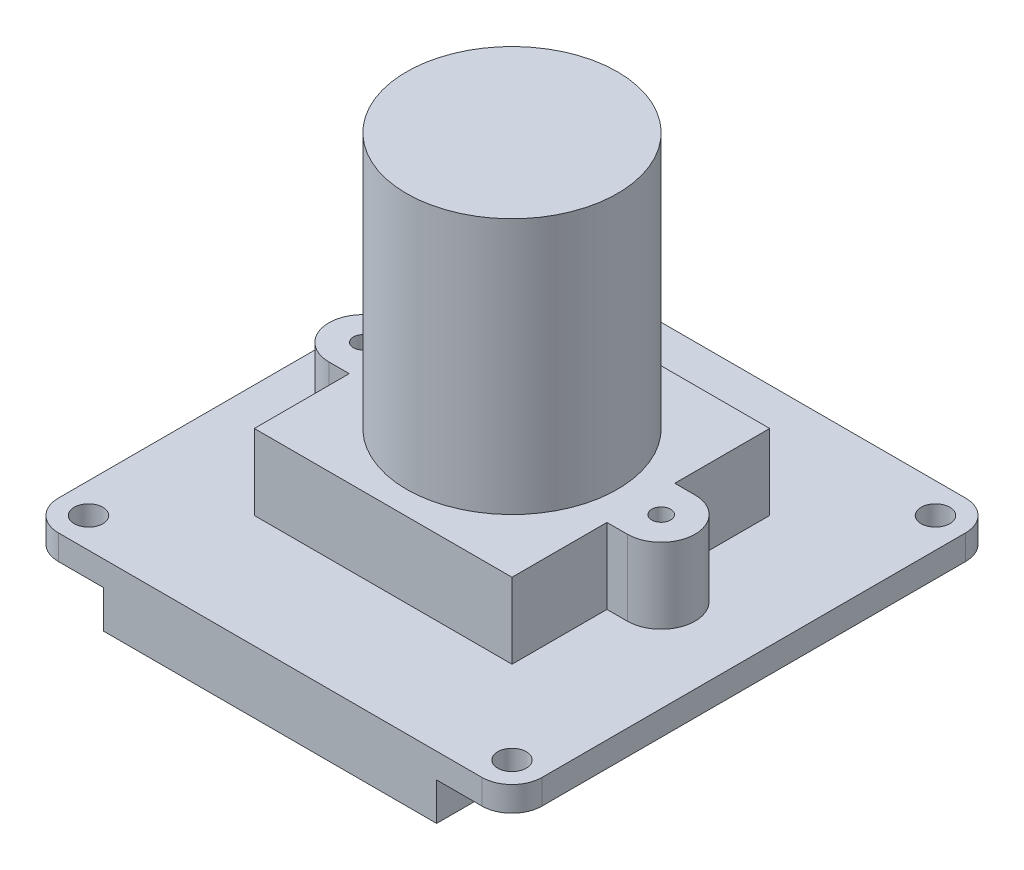
from build123d import *

# Parameters (mm, degrees)
SKETCH1_W           = 32.1
SKETCH1_H           = 32.1
SKETCH1_R           = 0.95
BOSS_EXTRUDE1_DEPTH = 1.65
SKETCH2_W           = 22.1
SKETCH2_H           = 6.75
BOSS_EXTRUDE2_DEPTH = 2.5
SKETCH3_R           = 0.625
BOSS_EXTRUDE3_DEPTH = 5
SKETCH4_R           = 7
BOSS_EXTRUDE4_DEPTH = 17
FILLET1_R           = 2


with BuildPart() as part:
    # Sketch1 → Boss-Extrude1 (new body)
    with BuildSketch(Plane(origin=(0, 0, 0), x_dir=(1, 0, 0), z_dir=(0, 1, 0))):
        Rectangle(SKETCH1_W, SKETCH1_H)
        with Locations(Location((-14.05, 14.05, 0), (0, 0, 270))):
            Circle(SKETCH1_R, mode=Mode.SUBTRACT)
        with Locations(Location((14.05, 14.05, 0), (0, 0, 90))):
            Circle(SKETCH1_R, mode=Mode.SUBTRACT)
        with Locations(Location((14.05, -14.05, 0), (0, 0, 270))):
            Circle(SKETCH1_R, mode=Mode.SUBTRACT)
        with Locations(Location((-14.05, -14.05, 0), (0, 0, 90))):
            Circle(SKETCH1_R, mode=Mode.SUBTRACT)
    extrude(amount=BOSS_EXTRUDE1_DEPTH)

    # Sketch2 → Boss-Extrude2 (add)
    with BuildSketch(Plane.XZ):
        with Locations((0, 12.675)):
            Rectangle(SKETCH2_W, SKETCH2_H)
    extrude(amount=BOSS_EXTRUDE2_DEPTH)

    # Sketch3 → Boss-Extrude3 (add)
    with BuildSketch(Plane(origin=(0, 1.65, 0), x_dir=(1, 0, 0), z_dir=(0, 1, 0))):
        with BuildLine():
            Line((9.9, 2.25), (8.55, 2.25))
            Line((8.55, 2.25), (8.55, 8.55))
            Line((8.55, 8.55), (-8.55, 8.55))
            Line((-8.55, 8.55), (-8.55, 2.25))
            Line((-8.55, 2.25), (-9.9, 2.25))
            ThreePointArc((-9.9, 2.25), (-12.15, 0), (-9.9, -2.25))
            Line((-9.9, -2.25), (-8.55, -2.25))
            Line((-8.55, -2.25), (-8.55, -8.55))
            Line((-8.55, -8.55), (8.55, -8.55))
            Line((8.55, -8.55), (8.55, -2.25))
            Line((8.55, -2.25), (9.9, -2.25))
            ThreePointArc((9.9, -2.25), (12.15, 0), (9.9, 2.25))
        make_face()
        with Locations(Location((9.9, 0, 0), (0, 0, 270))):
            Circle(SKETCH3_R, mode=Mode.SUBTRACT)
        with Locations(Location((-9.9, 0, 0), (0, 0, 90))):
            Circle(SKETCH3_R, mode=Mode.SUBTRACT)
    extrude(amount=BOSS_EXTRUDE3_DEPTH)

    # Sketch4 → Boss-Extrude4 (add)
    with BuildSketch(Plane(origin=(0, 6.65, 0), x_dir=(1, 0, 0), z_dir=(0, 1, 0))):
        with Locations(Location((0, 0, 0), (0, 0, 270))):
            Circle(SKETCH4_R)
    extrude(amount=BOSS_EXTRUDE4_DEPTH)

    # Fillet1
    fillet1_edges = [part.edges().sort_by_distance(p)[0] for p in [
        (-16.05, 0.825, -16.05),
        (16.05, 0.825, -16.05),
        (16.05, 0.825, 16.05),
        (-16.05, 0.825, 16.05),
    ]]
    fillet(fillet1_edges, radius=FILLET1_R)


solid = part.part
